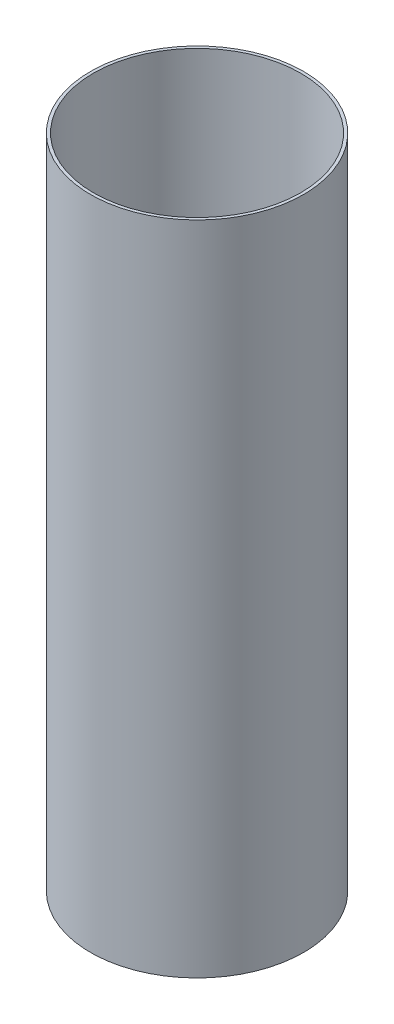
from build123d import *

# Parameters (mm, degrees)
SKETCH1_R           = 78.359
SKETCH1_R_2         = 76.2
BOSS_EXTRUDE1_DEPTH = 482.6


with BuildPart() as part:
    # Sketch1 → Boss-Extrude1 (new body)
    with BuildSketch(Plane(origin=(0, 0, 0), x_dir=(1, 0, 0), z_dir=(0, 1, 0))):
        with Locations(Location((0, 0, 0), (0, 0, 90))):
            Circle(SKETCH1_R)
        with Locations(Location((0, 0, 0), (0, 0, 90))):
            Circle(SKETCH1_R_2, mode=Mode.SUBTRACT)
    extrude(amount=BOSS_EXTRUDE1_DEPTH)


solid = part.part
